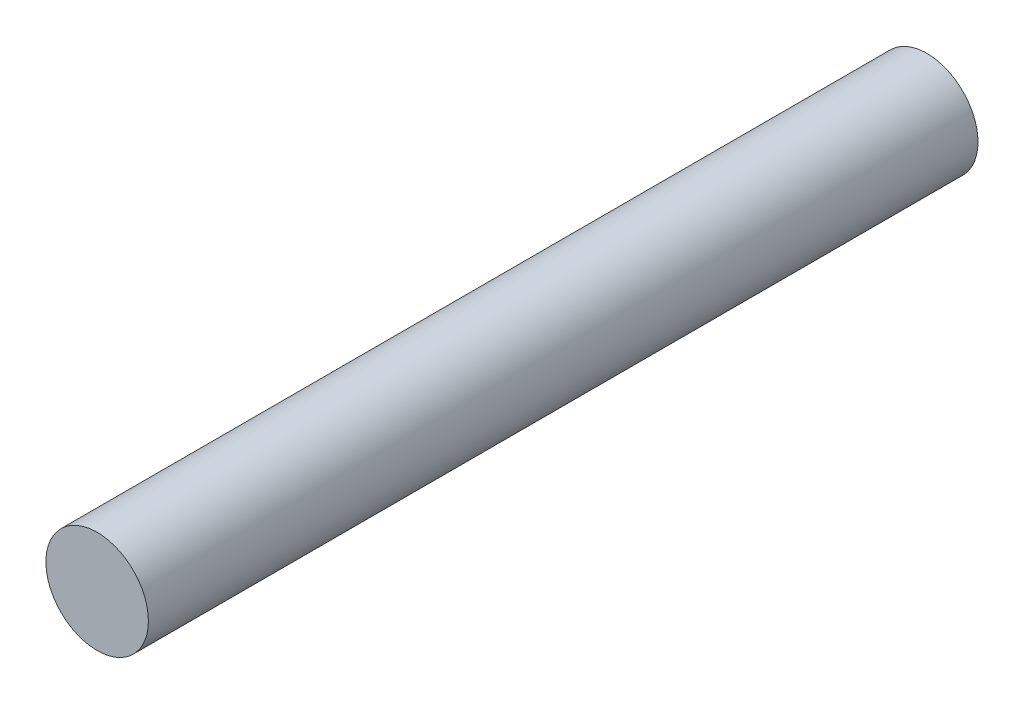
from build123d import *

# Parameters (mm, degrees)
CROQUIS2_R              = 5
SALIENTE_EXTRUIR1_DEPTH = 80.95


with BuildPart() as part:
    # Croquis2 → Saliente-Extruir1 (new body)
    with BuildSketch(Plane.XY):
        Circle(CROQUIS2_R)
    extrude(amount=SALIENTE_EXTRUIR1_DEPTH)


solid = part.part
